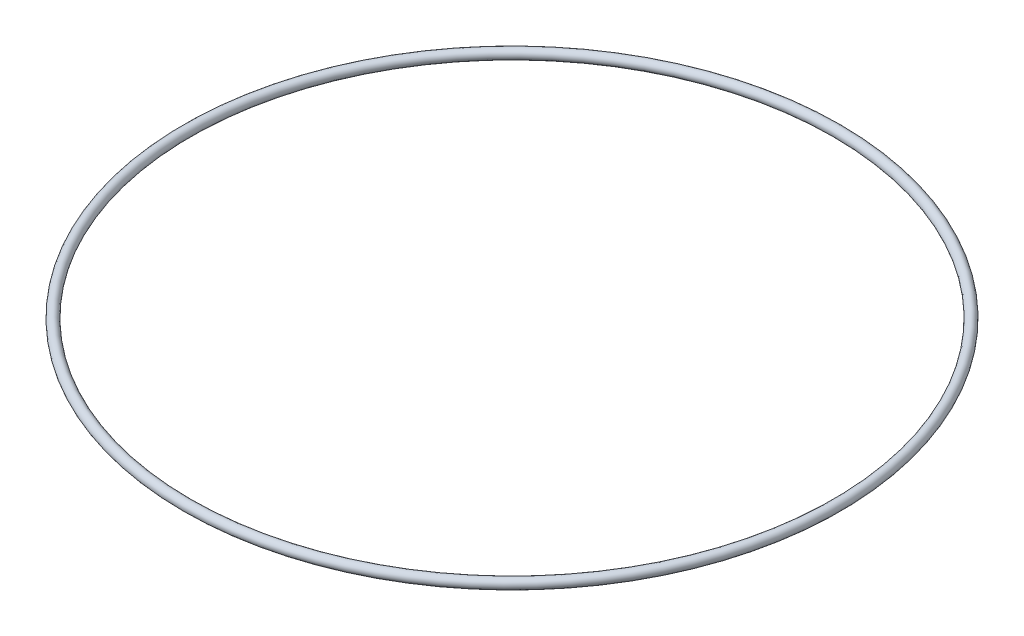
from build123d import *

# Parameters (mm, degrees)
SKETCH1_R = 3


with BuildPart() as part:
    # Sketch1 → Revolve1 (revolve)
    with BuildSketch(Plane.XY, mode=Mode.PRIVATE) as revolve1_sk:
        with Locations((197, 0)):
            Circle(SKETCH1_R)
    revolve(revolve1_sk.sketch.rotate(Axis((0, -50, 0), (0, 1, 0)), 90), axis=Axis((0, -50, 0), (0, 1, 0)))


solid = part.part
